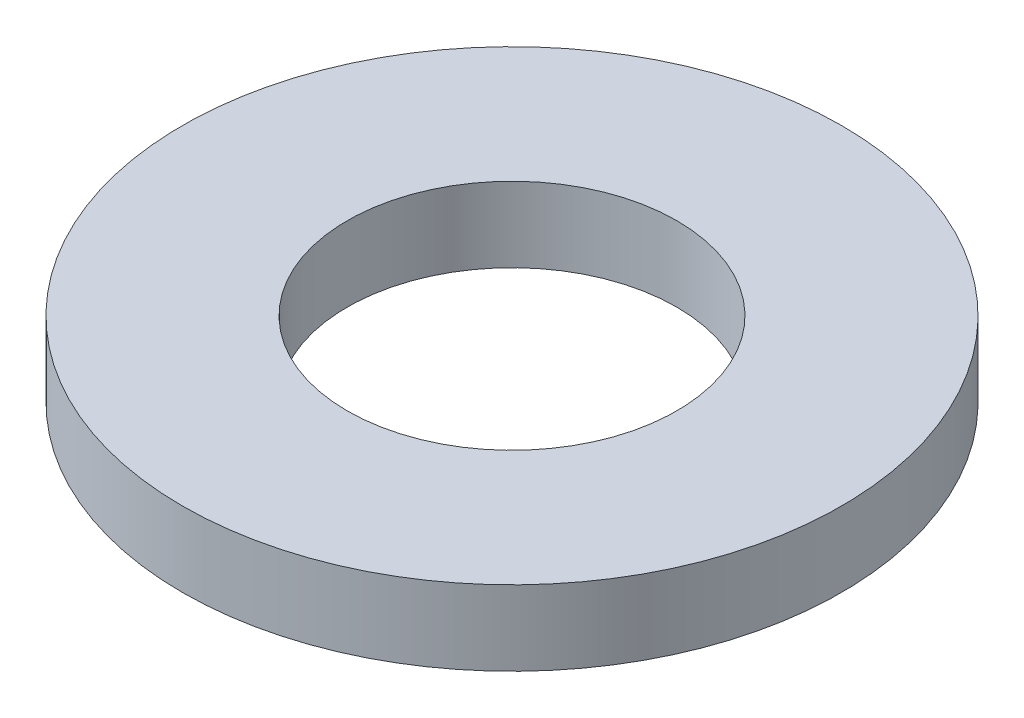
from build123d import *

# Parameters (mm, degrees)
SKETCH1_R           = 110
SKETCH1_R_2         = 55
BOSS_EXTRUDE1_DEPTH = 12.5


with BuildPart() as part:
    # Sketch1 → Boss-Extrude1 (new, symmetric)
    with BuildSketch(Plane(origin=(0, 0, 0), x_dir=(1, 0, 0), z_dir=(0, 1, 0))):
        with Locations(Location((0, 0, 0), (0, 0, 270))):
            Circle(SKETCH1_R)
        with Locations(Location((0, 0, 0), (0, 0, 270))):
            Circle(SKETCH1_R_2, mode=Mode.SUBTRACT)
    extrude(amount=BOSS_EXTRUDE1_DEPTH, both=True)


solid = part.part
